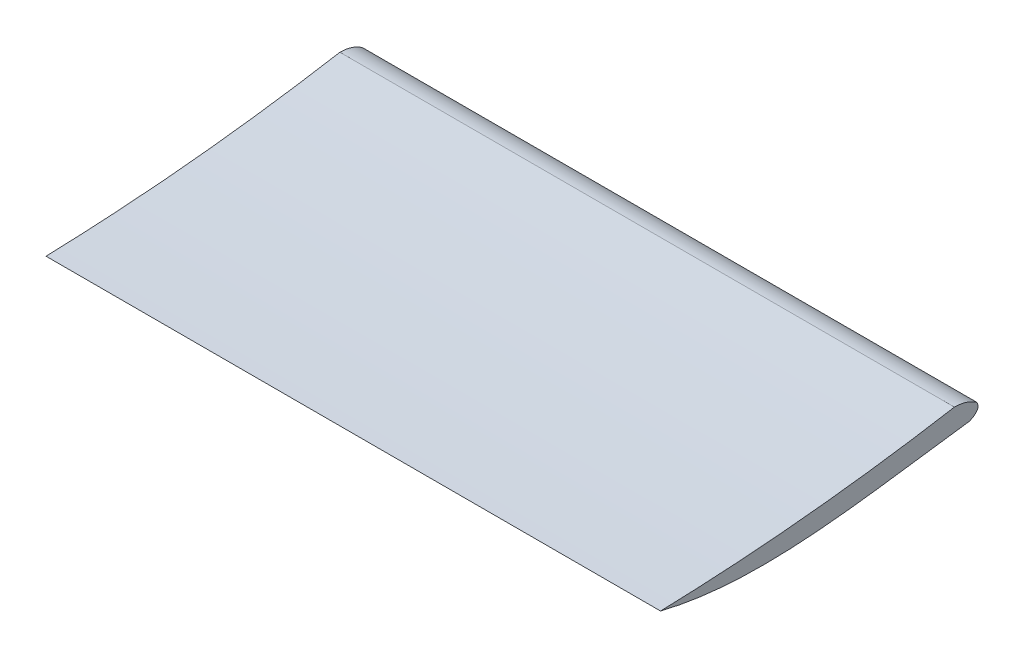
from build123d import *

# Parameters (mm, degrees)
BOSS_EXTRUDE1_DEPTH = 203.2


with BuildPart() as part:
    # Sketch2 → Boss-Extrude1 (new body)
    with BuildSketch(Plane(origin=(0, 0, 0), x_dir=(0, 0.01745240643728355, -0.9998476951563913), z_dir=(1, 0, 0))):
        with BuildLine():
            add(Edge.make_bspline(
                [(0, 0), (-3.263833068, 2.372808667), (-7.390426932, 2.489034967)],
                knots=[0, 0, 0, 1, 1, 1], degree=2))
            add(Edge.make_bspline(
                [(-104.707778225, -5.635267518), (-55.789715083, -5.019242012), (-7.390426932, 2.489034967)],
                knots=[0, 0, 0, 1, 1, 1], degree=2))
            add(Edge.make_bspline(
                [(-2.532475971, -4.141392581), (-36.361728446, -7.816963238), (-70.825265543, -14.614560516), (-104.707778225, -5.635267518)],
                knots=[0, 0, 0, 0, 1, 1, 1, 1], degree=3))
            add(Edge.make_bspline(
                [(-2.532475971, -4.141392581), (1.341150864, -2.598826907), (0, 0)],
                knots=[0, 0, 0, 1, 1, 1], degree=2))
        make_face()
    extrude(amount=BOSS_EXTRUDE1_DEPTH)


solid = part.part
